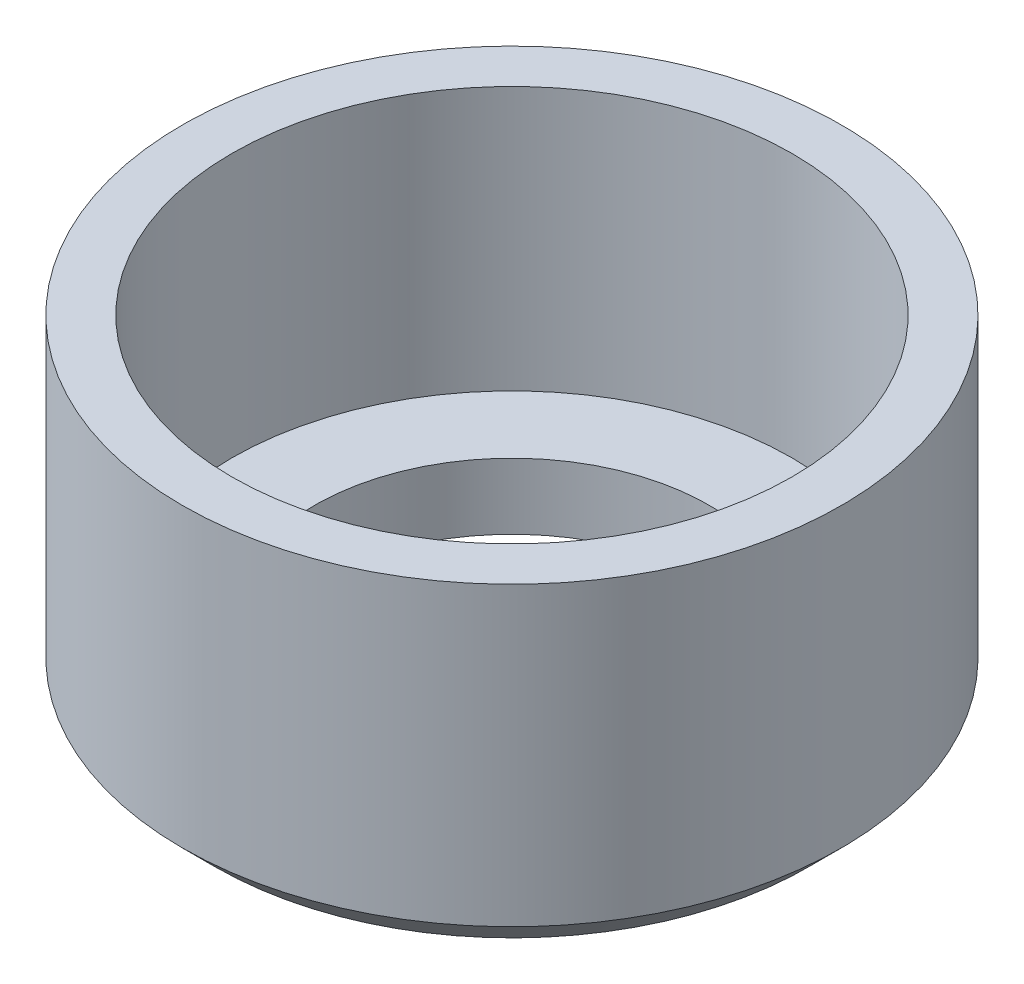
from build123d import *

# Parameters (mm, degrees)
SKETCH2_R           = 10
SKETCH2_R_2         = 6
BOSS_EXTRUDE1_DEPTH = 10
SKETCH3_R           = 8.5
CUT_EXTRUDE1_DEPTH  = 8
CHAMFER1_SIZE       = 1


with BuildPart() as part:
    # Sketch2 → Boss-Extrude1 (new body)
    with BuildSketch(Plane(origin=(0, 0, 0), x_dir=(1, 0, 0), z_dir=(0, 1, 0))):
        with Locations(Location((0, 0, 0), (0, 0, 270))):
            Circle(SKETCH2_R)
        with Locations(Location((0, 0, 0), (0, 0, 270))):
            Circle(SKETCH2_R_2, mode=Mode.SUBTRACT)
    extrude(amount=BOSS_EXTRUDE1_DEPTH)

    # Sketch3 → Cut-Extrude1 (cut)
    with BuildSketch(Plane(origin=(0, 10, 0), x_dir=(1, 0, 0), z_dir=(0, 1, 0))):
        with Locations(Location((0, 0, 0), (0, 0, 270))):
            Circle(SKETCH3_R)
    extrude(amount=-CUT_EXTRUDE1_DEPTH, mode=Mode.SUBTRACT)

    # Chamfer1
    chamfer1_edges = [part.edges().sort_by_distance(p)[0] for p in [
        (0, 0, -10),
    ]]
    chamfer(chamfer1_edges, length=CHAMFER1_SIZE)


solid = part.part
